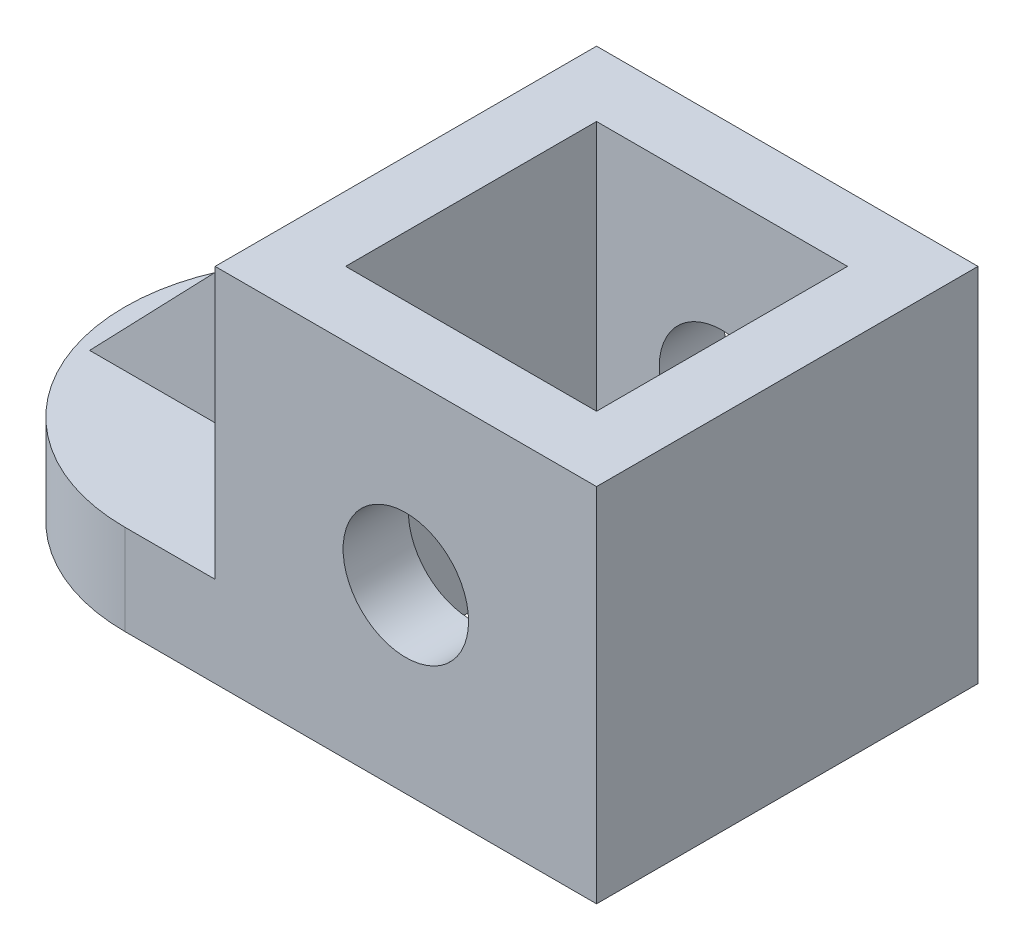
from build123d import *

# Parameters (mm, degrees)
Y_KSEKLIK_EKSTR_ZYON3_DEPTH = 76
IZIM9_W                     = 50
IZIM9_H                     = 50
KES_EKSTR_ZYON2_DEPTH       = 72
RADYUS2_RADIUS              = 38
RADYUS2_LENGTH              = 18
IZIM10_R                    = 12.5
KES_EKSTR_ZYON3_DEPTH       = 260.686142434
FEDER1_REACH                = 253.207
IZIM11_WALL_W               = 579.380403386
IZIM11_WALL_H               = 22


with BuildPart() as part:
    # Çizim8 → Yükseklik-Ekstrüzyon3 (new body)
    with BuildSketch(Plane.XY):
        Polygon((-185.934081036, 55.935614824), (-109.934081036, 55.935614824), (-109.934081036, -16.064385176), (-241.934081036, -16.064385176), (-241.934081036, 1.935614824), (-185.934081036, 1.935614824), align=None)
    extrude(amount=Y_KSEKLIK_EKSTR_ZYON3_DEPTH)

    # Çizim9 → Kes-Ekstrüzyon2 (cut)
    with BuildSketch(Plane(origin=(0, 55.935614824, 0), x_dir=(1, 0, 0), z_dir=(0, 1, 0))):
        with Locations((-147.934081036, -38)):
            Rectangle(IZIM9_W, IZIM9_H)
    extrude(amount=-KES_EKSTR_ZYON2_DEPTH, mode=Mode.SUBTRACT)

    # Radyus2: full round fillet: the end face becomes a half cylinder, R = half its width
    radyus2_face = Plane((-241.934081036, -7.064385176, 38), x_dir=(0, 1, 0), z_dir=(-1, 0, 0))  # on the end face: x along it, z out of the body
    radyus2_slab = radyus2_face.offset(-RADYUS2_RADIUS / 2) * Box(RADYUS2_LENGTH, 2 * RADYUS2_RADIUS, RADYUS2_RADIUS, mode=Mode.PRIVATE)  # the body's end, R deep
    radyus2_round = Plane((-203.934081036, -7.064385176, 38), x_dir=(-1, 0, 0), z_dir=(0, 1, 0)) * Cylinder(RADYUS2_RADIUS, RADYUS2_LENGTH, mode=Mode.PRIVATE)  # its axis R under the face
    add(radyus2_slab - radyus2_round, mode=Mode.SUBTRACT)

    # Çizim10 → Kes-Ekstrüzyon3 (cut, through all)
    with BuildSketch(Plane.XY.offset(76)):
        with Locations((-147.934081036, 19.935614824)):
            Circle(IZIM10_R)
    extrude(amount=-KES_EKSTR_ZYON3_DEPTH, mode=Mode.SUBTRACT)

    # Çizim11 wall → Feder1 (add, up to next)
    with BuildSketch(Plane(origin=(-211.934081036, 28.935614824, 38), x_dir=(-0.693641687066, -0.720320213491, 0), z_dir=(0.720320213491, -0.693641687066, 0)), mode=Mode.PRIVATE) as feder1_sk1:
        Rectangle(IZIM11_WALL_W, IZIM11_WALL_H)
    feder1_tool1 = extrude(feder1_sk1.sketch, amount=FEDER1_REACH, mode=Mode.PRIVATE) - part.part
    add(feder1_tool1.solids().sort_by_distance((-211.934081036, 28.935614824, 38))[0])


solid = part.part
